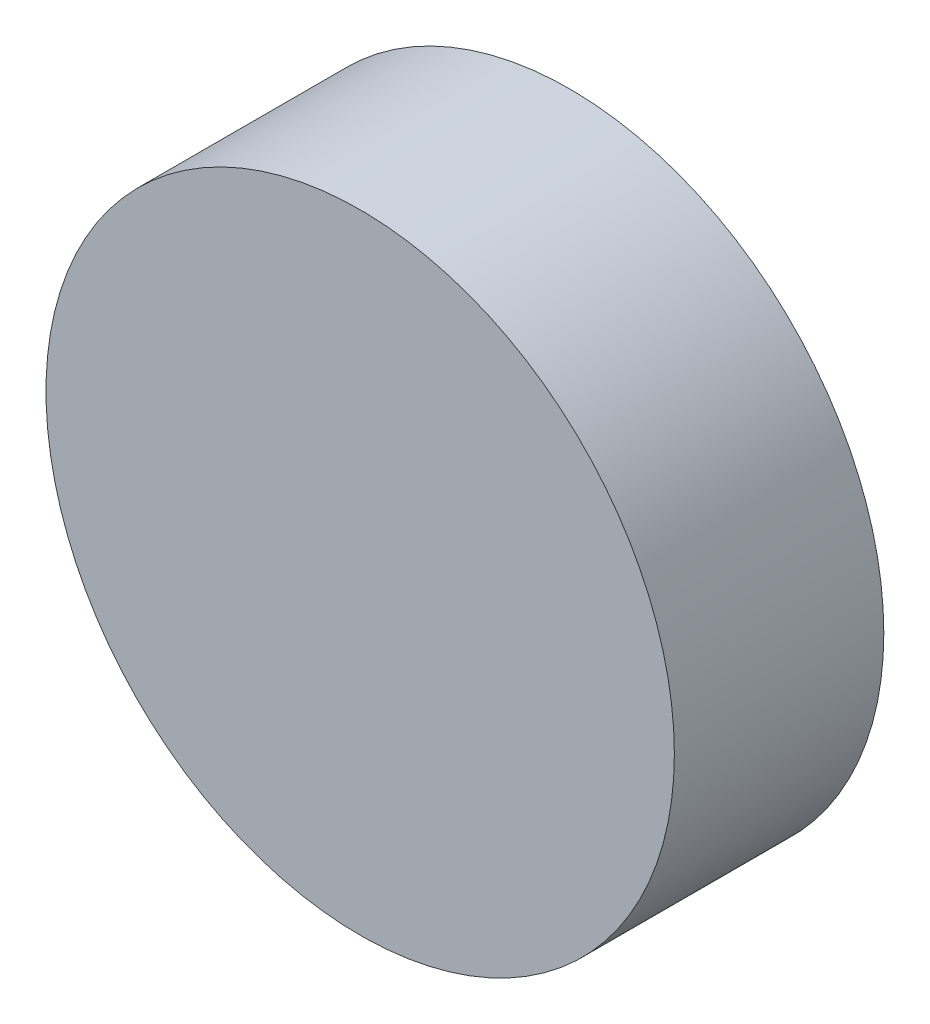
from build123d import *

# Parameters (mm, degrees)
CROQUIS1_R              = 3
SALIENTE_EXTRUIR1_DEPTH = 2


with BuildPart() as part:
    # Croquis1 → Saliente-Extruir1 (new body)
    with BuildSketch(Plane.XY):
        Circle(CROQUIS1_R)
    extrude(amount=SALIENTE_EXTRUIR1_DEPTH)


solid = part.part
